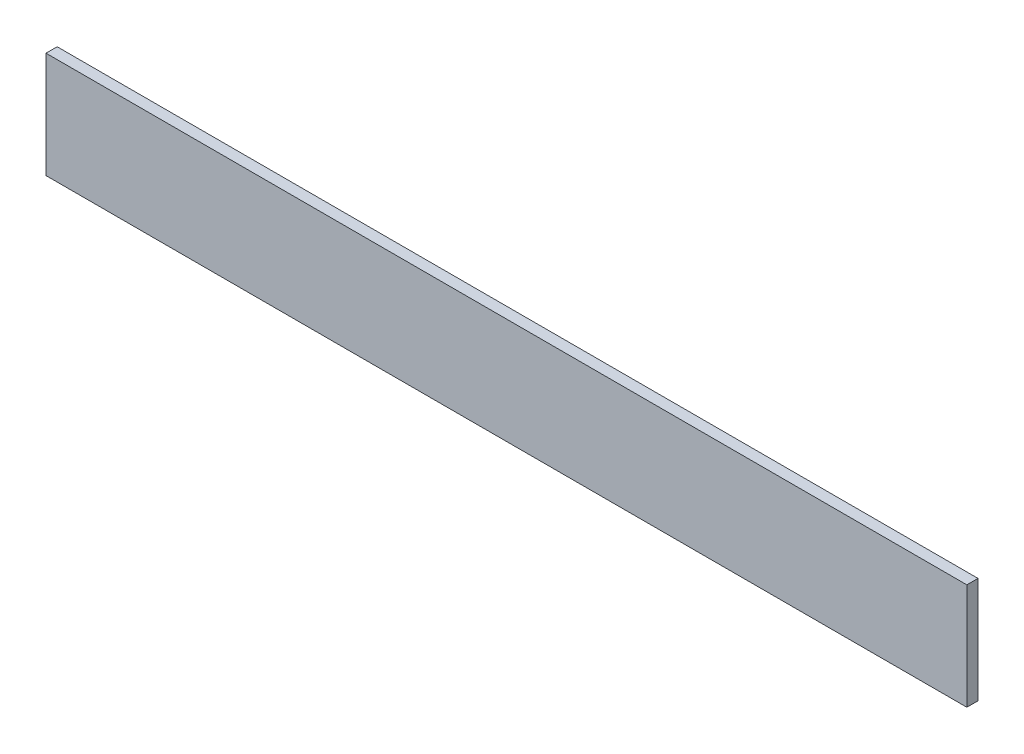
from build123d import *

# Parameters (mm, degrees)
SKETCH_1_W      = 660
SKETCH_1_H      = 76
EXTRUDE_1_DEPTH = 8


with BuildPart() as part:
    # 草图1 → 凸台-拉伸1 (new body)
    with BuildSketch(Plane.XY):
        with Locations((330, -38)):
            Rectangle(SKETCH_1_W, SKETCH_1_H)
    extrude(amount=EXTRUDE_1_DEPTH)


solid = part.part
